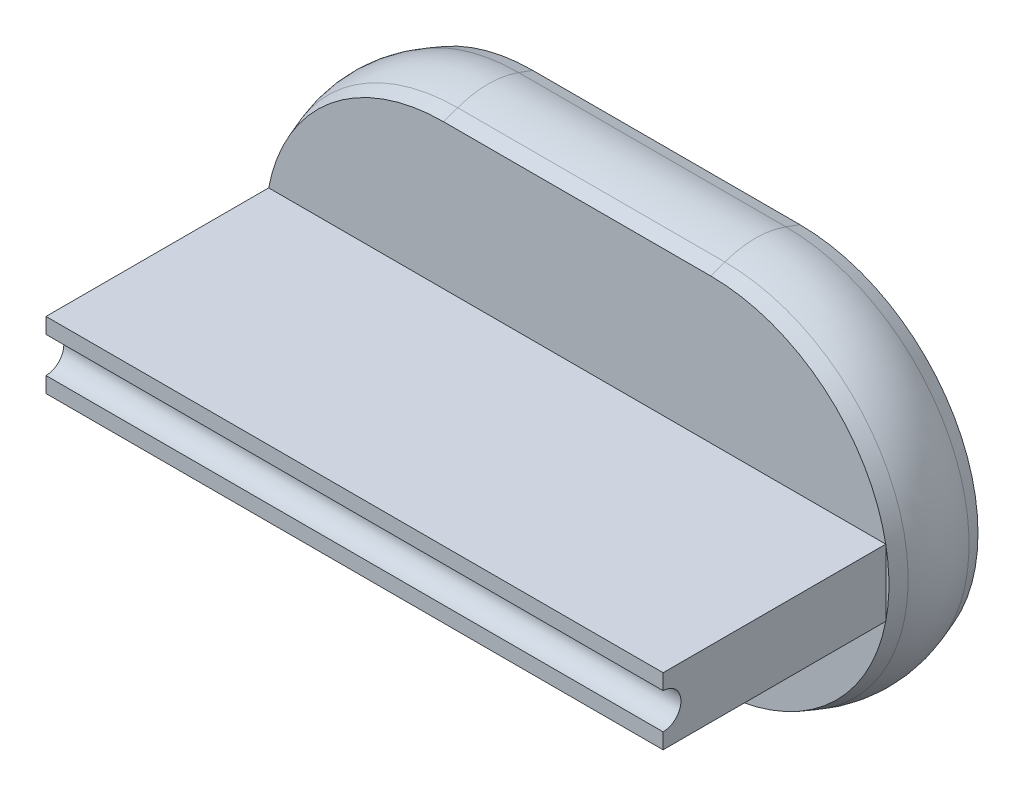
from build123d import *

# Parameters (mm, degrees)
BOSS_EXTRUDE1_DEPTH     = 5
BOSS_EXTRUDE1_DRAFT     = 20
MIRROR1_COPY_1_DEPTH    = 5
MIRROR1_COPY_1_DRAFT    = 20
FILLET1_R               = 10
CUT_EXTRUDE1_DEPTH      = 0.5
SKETCH3_R               = 3.628485538
CUT_EXTRUDE2_DEPTH      = 1
CUT_EXTRUDE2_DRAFT      = -20
SKETCH4_W               = 69.290584113
SKETCH4_H               = 7.5
BOSS_EXTRUDE2_DEPTH     = 25
CUT_EXTRUDE3_DEPTH      = 79.012436871
CUT_EXTRUDE3_DEPTH_BACK = 70


with BuildPart() as part:
    # Sketch1 → Boss-Extrude1 (with draft: the straight prism first)
    with BuildSketch(Plane.XY):
        with BuildLine():
            ThreePointArc((-20.793357934, 20), (-40.793357934, 0), (-20.793357934, -20))
            Line((-20.793357934, -20), (9.206642066, -20))
            ThreePointArc((9.206642066, -20), (29.206642066, 0), (9.206642066, 20))
            Line((9.206642066, 20), (-20.793357934, 20))
        make_face()
    extrude(amount=-BOSS_EXTRUDE1_DEPTH)
    # Boss-Extrude1: the draft: its side faces are tilted about the plane it starts from
    boss_extrude1_sides = [part.faces().sort_by_distance(p)[0] for p in [
        (-5.793357934, -20, -2.5),
        (29.206642066, 0, -2.5),
        (-5.793357934, 20, -2.5),
        (-40.793357934, 0, -2.5),
    ]]
    draft(boss_extrude1_sides, Plane.XY, BOSS_EXTRUDE1_DRAFT)


with BuildPart() as mirror1_copy_1_tool:
    # Mirror1 copy 1 sketch → Mirror1 copy 1 (with draft: the straight prism first)
    with BuildSketch(Plane(origin=(0, 0, -10), x_dir=(1, 0, 0), z_dir=(0, 0, -1))):
        with BuildLine():
            ThreePointArc((-20.793357934, -20), (-40.793357934, 0), (-20.793357934, 20))
            Line((-20.793357934, 20), (9.206642066, 20))
            ThreePointArc((9.206642066, 20), (29.206642066, 0), (9.206642066, -20))
            Line((9.206642066, -20), (-20.793357934, -20))
        make_face()
    extrude(amount=-MIRROR1_COPY_1_DEPTH)
    # Mirror1 copy 1: the draft: its side faces are tilted about the plane it starts from
    mirror1_copy_1_sides = [mirror1_copy_1_tool.faces().sort_by_distance(p)[0] for p in [
        (-5.793357934, -20, -7.5),
        (29.206642066, 0, -7.5),
        (-5.793357934, 20, -7.5),
        (-40.793357934, 0, -7.5),
    ]]
    draft(mirror1_copy_1_sides, Plane(origin=(0, 0, -10), x_dir=(1, 0, 0), z_dir=(0, 0, -1)), MIRROR1_COPY_1_DRAFT)


with BuildPart() as part_1:
    add(part.part)

    # Mirror1 copy 1: add mirror1_copy_1_tool
    add(mirror1_copy_1_tool.part)

    # Fillet1
    fillet1_edges = [part_1.edges().sort_by_distance(p)[0] for p in [
        (31.026493238, 0, -5),
        (-5.793357934, 21.819851171, -5),
        (-42.613209105, 0, -5),
        (-5.793357934, -21.819851171, -5),
    ]]
    fillet(fillet1_edges, radius=FILLET1_R)

    # Sketch2 → Cut-Extrude1 (cut)
    with BuildSketch(Plane(origin=(0, 0, -10), x_dir=(-1, 0, 0), z_dir=(0, 0, -1))):
        with BuildLine():
            Line((-17.429161642, 6.728379016), (-2.895862967, 6.728379016))
            ThreePointArc((-2.895862967, 6.728379016), (3.832516049, 0), (-2.895862967, -6.728379016))
            Line((-2.895862967, -6.728379016), (-17.429161642, -6.728379016))
            ThreePointArc((-17.429161642, -6.728379016), (-24.157540659, 0), (-17.429161642, 6.728379016))
        make_face()
    extrude(amount=-CUT_EXTRUDE1_DEPTH, mode=Mode.SUBTRACT)


with BuildPart() as cut_extrude2_tool:
    # Sketch3 → Cut-Extrude2 (with draft: the straight prism first)
    with BuildSketch(Plane(origin=(0, 0, -9.5), x_dir=(-1, 0, 0), z_dir=(0, 0, -1))):
        with Locations((-17.44999147, 0)):
            Circle(SKETCH3_R)
    extrude(amount=-CUT_EXTRUDE2_DEPTH)
    # Cut-Extrude2: the draft: its side faces are tilted about the plane it starts from
    cut_extrude2_sides = [cut_extrude2_tool.faces().sort_by_distance(p)[0] for p in [
        (21.078477008, 0, -9),
    ]]
    draft(cut_extrude2_sides, Plane(origin=(0, 0, -9.5), x_dir=(-1, 0, 0), z_dir=(0, 0, -1)), CUT_EXTRUDE2_DRAFT)


with BuildPart() as part_2:
    add(part_1.part)

    # Cut-Extrude2: cut by cut_extrude2_tool
    add(cut_extrude2_tool.part, mode=Mode.SUBTRACT)

    # Sketch4 → Boss-Extrude2 (add)
    with BuildSketch(Plane.XY):
        with Locations((-5.793357933, 0)):
            Rectangle(SKETCH4_W, SKETCH4_H)
    extrude(amount=BOSS_EXTRUDE2_DEPTH)

    # Sketch5 → Cut-Extrude3 (cut, two sides: drawn at the far end of the back side and taken through both)
    with BuildSketch(Plane.ZY.offset(40.43864999).offset(-CUT_EXTRUDE3_DEPTH_BACK)):
        with BuildLine():
            Line((118.957682206, 2), (25, 2))
            ThreePointArc((25, 2), (23, 0), (25, -2))
            Line((25, -2), (118.957682206, -2))
            Line((118.957682206, -2), (306.873046617, -2))
            Line((306.873046617, -2), (306.873046617, 2))
            Line((306.873046617, 2), (118.957682206, 2))
        make_face()
    extrude(amount=CUT_EXTRUDE3_DEPTH + CUT_EXTRUDE3_DEPTH_BACK, mode=Mode.SUBTRACT)


solid = part_2.part
